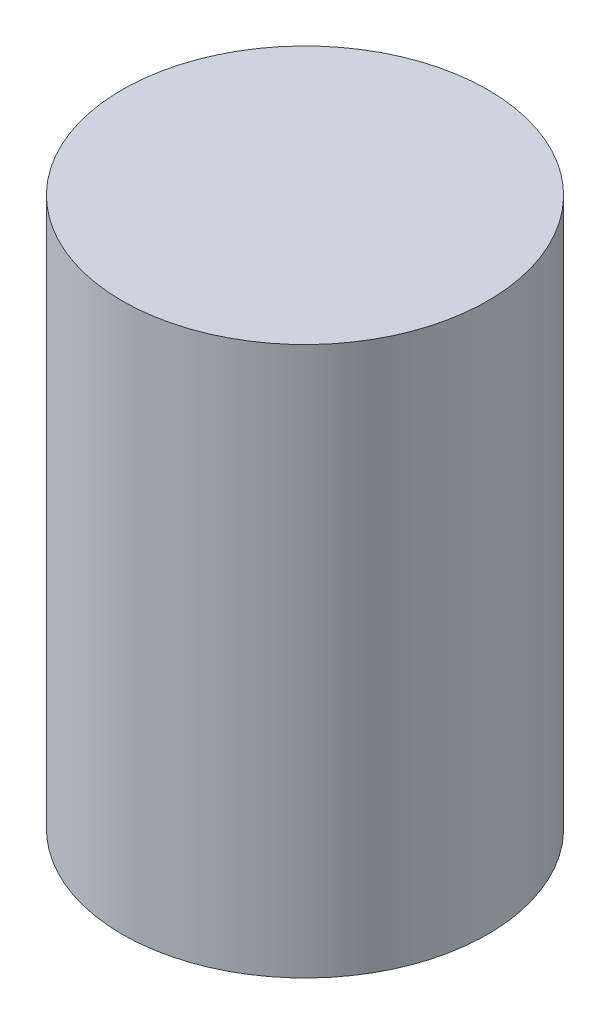
from build123d import *

# Parameters (mm, degrees)
SKETCH1_R           = 3
BOSS_EXTRUDE1_DEPTH = 9


with BuildPart() as part:
    # Sketch1 → Boss-Extrude1 (new body)
    with BuildSketch(Plane(origin=(0, 0, 0), x_dir=(1, 0, 0), z_dir=(0, 1, 0))):
        with Locations(Location((0, 0, 0), (0, 0, 270))):
            Circle(SKETCH1_R)
    extrude(amount=BOSS_EXTRUDE1_DEPTH)


solid = part.part
